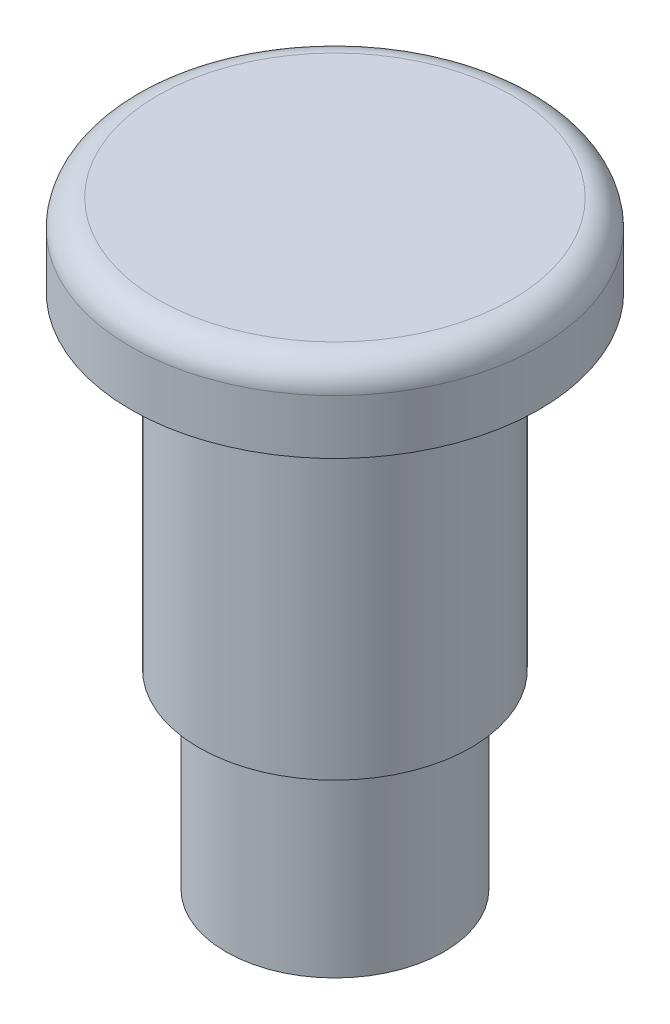
from build123d import *


with BuildPart() as part:
    # Sketch1 → Revolve1 (revolve)
    with BuildSketch(Plane.XY, mode=Mode.PRIVATE) as revolve1_sk:
        with BuildLine():
            Line((0, 0), (-4, 0))
            Line((-4, 0), (-4, 7))
            Line((-4, 7), (-5, 7))
            Line((-5, 7), (-5, 19))
            Line((-5, 19), (-7.5, 19))
            Line((-7.5, 19), (-7.5, 21))
            ThreePointArc((-7.5, 21), (-7.207106781, 21.707106781), (-6.5, 22))
            Line((-6.5, 22), (0, 22))
            Line((0, 22), (0, 0))
        make_face()
    revolve(revolve1_sk.sketch.rotate(Axis((0, 22, 0), (0, -1, 0)), 270), axis=Axis((0, 22, 0), (0, -1, 0)))


solid = part.part
